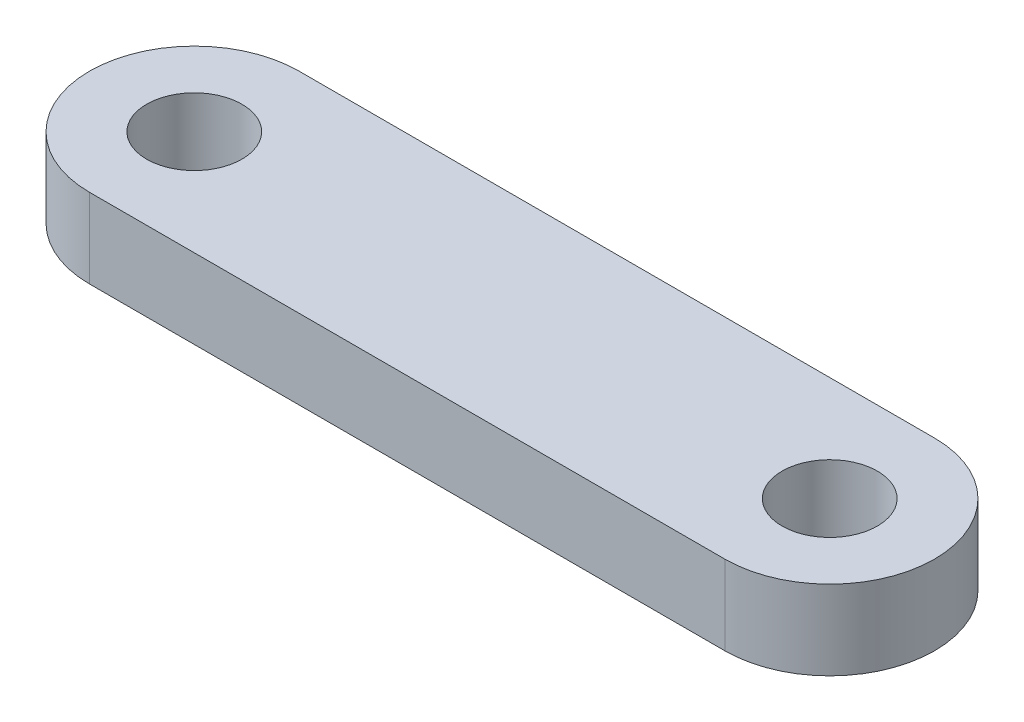
from build123d import *

# Parameters (mm, degrees)
SKETCH1_R           = 7.62
BOSS_EXTRUDE1_DEPTH = 12.7


with BuildPart() as part:
    # Sketch1 → Boss-Extrude1 (new body)
    with BuildSketch(Plane(origin=(0, 0, 0), x_dir=(1, 0, 0), z_dir=(0, 1, 0))):
        with BuildLine():
            Line((0, 16.764), (101.6, 16.764))
            ThreePointArc((101.6, 16.764), (118.364, 0), (101.6, -16.764))
            Line((101.6, -16.764), (0, -16.764))
            ThreePointArc((0, -16.764), (-16.764, 0), (0, 16.764))
        make_face()
        with Locations(Location((0, 0, 0), (0, 0, 270))):
            Circle(SKETCH1_R, mode=Mode.SUBTRACT)
        with Locations(Location((101.6, 0, 0), (0, 0, 270))):
            Circle(SKETCH1_R, mode=Mode.SUBTRACT)
    extrude(amount=BOSS_EXTRUDE1_DEPTH)


solid = part.part
